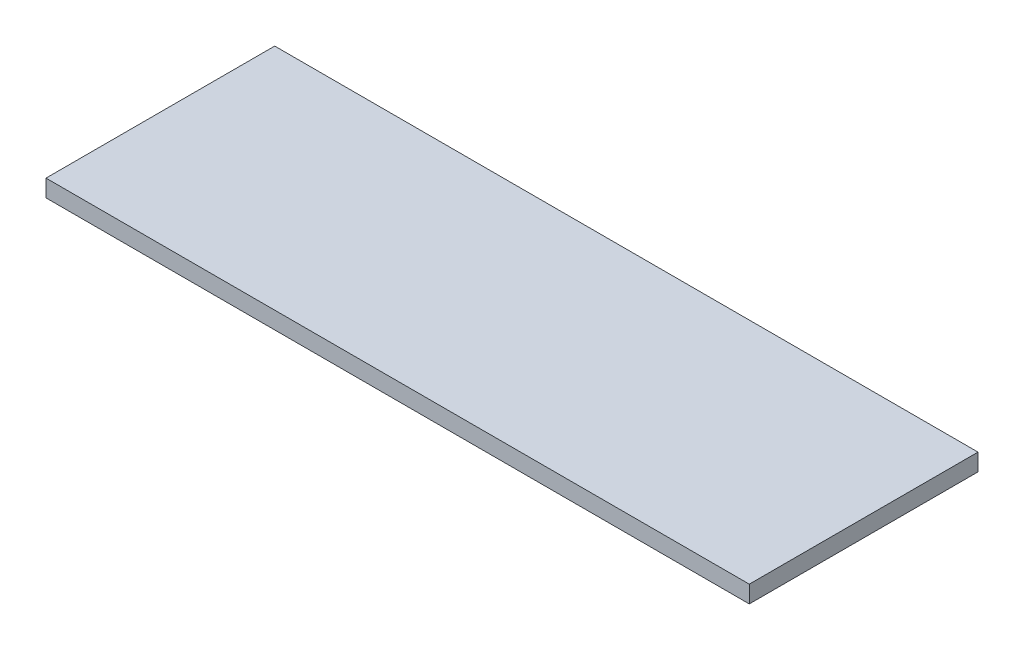
from build123d import *

# Parameters (mm, degrees)
CROQUIS1_W              = 615
CROQUIS1_H              = 200
SALIENTE_EXTRUIR1_DEPTH = 15


with BuildPart() as part:
    # Croquis1 → Saliente-Extruir1 (new body)
    with BuildSketch(Plane(origin=(0, 0, 0), x_dir=(1, 0, 0), z_dir=(0, 1, 0))):
        Rectangle(CROQUIS1_W, CROQUIS1_H)
    extrude(amount=SALIENTE_EXTRUIR1_DEPTH)


solid = part.part
